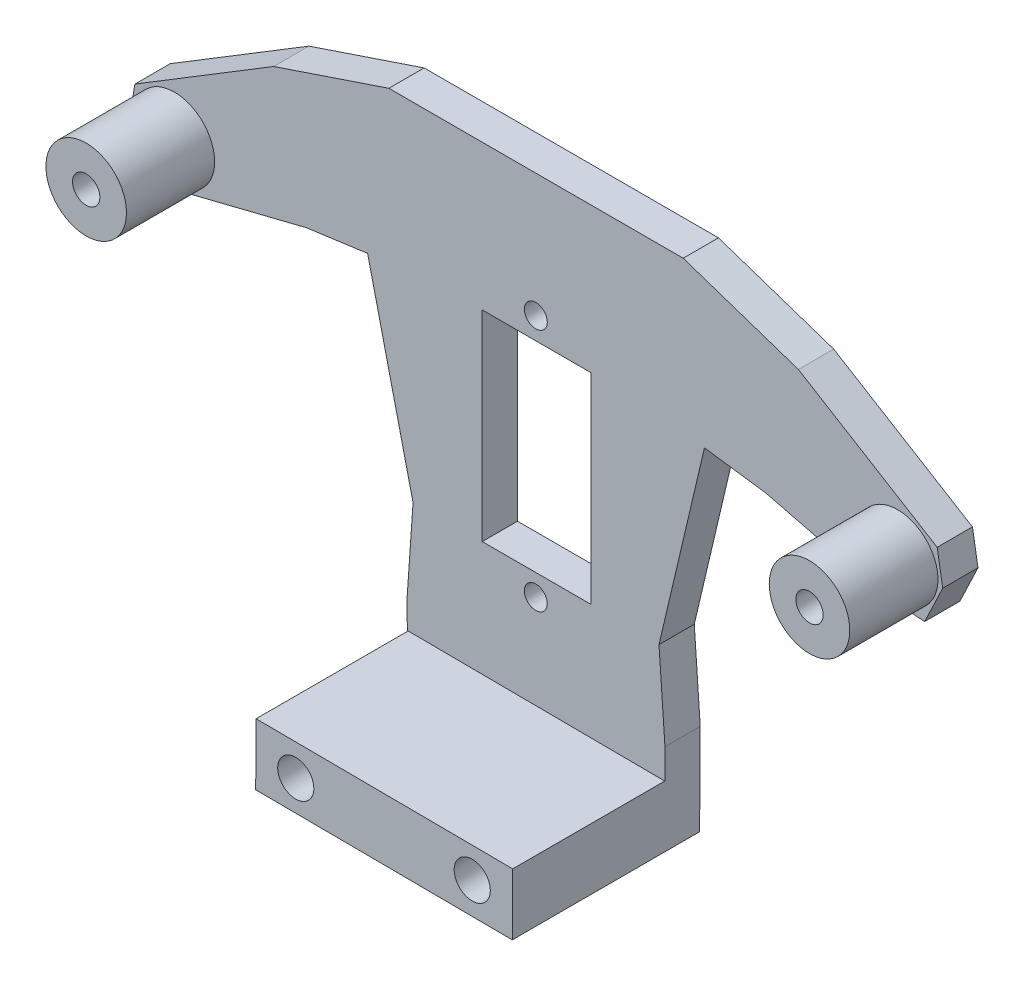
from build123d import *

# Parameters (mm, degrees)
BOSS_EXTRUDE1_DEPTH = 4
SKETCH2_W           = 12.35
SKETCH2_H           = 22.75
SKETCH2_W_2         = 12.2
SKETCH2_H_2         = 22.6
CUT_EXTRUDE10_DEPTH = 56.09122169
SKETCH6_R           = 4.5665
BOSS_EXTRUDE3_DEPTH = 10
SKETCH4_R           = 2.05
CUT_EXTRUDE11_DEPTH = 9.65
SKETCH15_R          = 1.3
CUT_EXTRUDE13_DEPTH = 9.65
SKETCH20_W          = 17.24
SKETCH20_H          = 7
BOSS_EXTRUDE4_DEPTH = 29.1
SKETCH14_R          = 2.05
CUT_EXTRUDE16_DEPTH = 58.586980363
SKETCH17_R          = 1.55
CUT_EXTRUDE17_DEPTH = 57.701346609


with BuildPart() as part:
    # Sketch1 → Boss-Extrude1 (new body)
    with BuildSketch(Plane.XY):
        Polygon((-16.687663097, 29.51713681), (16.687663097, 29.51713681), (29.751665716, 25.127138307), (45.48566771, 15.533136266), (46.115666453, 11.829137748), (44.06566621, 7.52513699), (39.527662855, 7.785135244), (26.057661336, 11.143136948), (19.095663738, 12.099134391), (13.943658967, -9.798863607), (14.617658977, -19.488863352), (14.549662185, -29.872864189), (-14.549662185, -29.872864189), (-14.619662252, -19.488863352), (-13.945660379, -9.798863607), (-19.097663288, 12.099134391), (-26.059662749, 11.143136948), (-39.529662405, 7.785135244), (-44.067662035, 7.52513699), (-46.113662247, 11.829137748), (-45.485663985, 15.533136266), (-29.75166199, 25.127138307), align=None)
    extrude(amount=BOSS_EXTRUDE1_DEPTH)

    # Sketch2 → Cut-Extrude10 (cut, through all)
    with BuildSketch(Plane.XY.offset(4)):
        with Locations((0.075, 1.67213681)):
            Rectangle(SKETCH2_W, SKETCH2_H)
        with Locations((0, 1.74713681)):
            Rectangle(SKETCH2_W_2, SKETCH2_H_2)
    extrude(amount=-CUT_EXTRUDE10_DEPTH, mode=Mode.SUBTRACT)

    # Sketch6 → Boss-Extrude3 (add)
    with BuildSketch(Plane.XY.offset(4)):
        with Locations((-41.008819859, 12.415108178)):
            Circle(SKETCH6_R)
        with Locations(Location((41.008819859, 12.415108178, 0), (0, 0, 180))):
            Circle(SKETCH6_R)
    extrude(amount=BOSS_EXTRUDE3_DEPTH)

    # Sketch4 → Cut-Extrude11 (cut)
    with BuildSketch(Plane.XY.offset(4)):
        with Locations((10.005, -26.272864189)):
            Circle(SKETCH4_R)
        with Locations((-10.005, -26.272864189)):
            Circle(SKETCH4_R)
    extrude(amount=-CUT_EXTRUDE11_DEPTH, mode=Mode.SUBTRACT)

    # Sketch15 → Cut-Extrude13 (cut)
    with BuildSketch(Plane.XY.offset(4)):
        with Locations((-0.026341033, -12.13286319)):
            Circle(SKETCH15_R)
        with Locations((-0.024336262, 15.52713681)):
            Circle(SKETCH15_R)
    extrude(amount=-CUT_EXTRUDE13_DEPTH, mode=Mode.SUBTRACT)

    # Sketch20 → Boss-Extrude4 (add)
    with BuildSketch(Plane(origin=(14.744644235, -0.096551274, 0), x_dir=(0, 0, -1), z_dir=(0.9999785610524021, -0.006548086405005186, 0))):
        with Locations((-12.62, -26.276951301)):
            Rectangle(SKETCH20_W, SKETCH20_H)
    extrude(amount=-BOSS_EXTRUDE4_DEPTH)

    # Sketch14 → Cut-Extrude16 (cut, through all)
    with BuildSketch(Plane.XY.offset(4)):
        with Locations((-10.005, -26.272864189)):
            Circle(SKETCH14_R)
        with Locations((10.005, -26.272864189)):
            Circle(SKETCH14_R)
    extrude(amount=CUT_EXTRUDE16_DEPTH, mode=Mode.SUBTRACT)

    # Sketch17 → Cut-Extrude17 (cut, through all)
    with BuildSketch(Plane.XY.offset(14)):
        with Locations((41.008819859, 12.415108178)):
            Circle(SKETCH17_R)
        with Locations(Location((-41.008819859, 12.415108178, 0), (0, 0, 180))):
            Circle(SKETCH17_R)
    extrude(amount=-CUT_EXTRUDE17_DEPTH, mode=Mode.SUBTRACT)


solid = part.part
